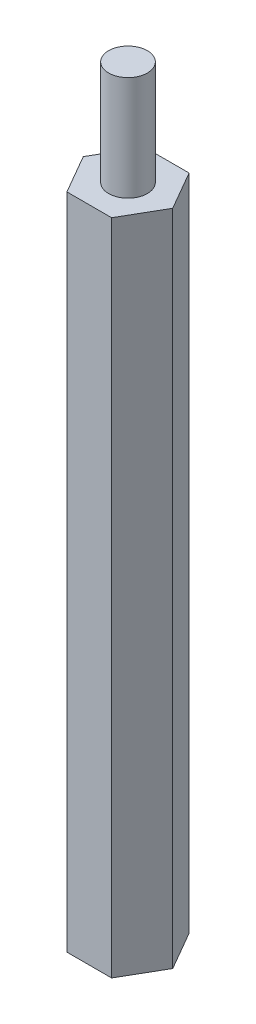
from build123d import *

# Parameters (mm, degrees)
BOSS_EXTRUDE1_DEPTH = 51
SKETCH5_R           = 1.5
BOSS_EXTRUDE2_DEPTH = 8.091605471
SKETCH6_R           = 1.5
CUT_EXTRUDE1_DEPTH  = 4


with BuildPart() as part:
    # Sketch3 → Boss-Extrude1 (new body)
    with BuildSketch(Plane(origin=(0, 0, 0), x_dir=(1, 0, 0), z_dir=(0, 1, 0))):
        Polygon((-3.464101615, 0), (-1.732050808, -3), (1.732050808, -3), (3.464101615, 0), (1.732050808, 3), (-1.732050808, 3), align=None)
    extrude(amount=BOSS_EXTRUDE1_DEPTH)

    # Sketch5 → Boss-Extrude2 (add)
    with BuildSketch(Plane(origin=(0, 51, 0), x_dir=(1, 0, 0), z_dir=(0, 1, 0))):
        with Locations(Location((0, 0, 0), (0, 0, 270))):
            Circle(SKETCH5_R)
    extrude(amount=BOSS_EXTRUDE2_DEPTH)

    # Sketch6 → Cut-Extrude1 (cut)
    with BuildSketch(Plane.XZ):
        with Locations(Location((0, 0, 0), (0, 0, 90))):
            Circle(SKETCH6_R)
    extrude(amount=-CUT_EXTRUDE1_DEPTH, mode=Mode.SUBTRACT)


solid = part.part
